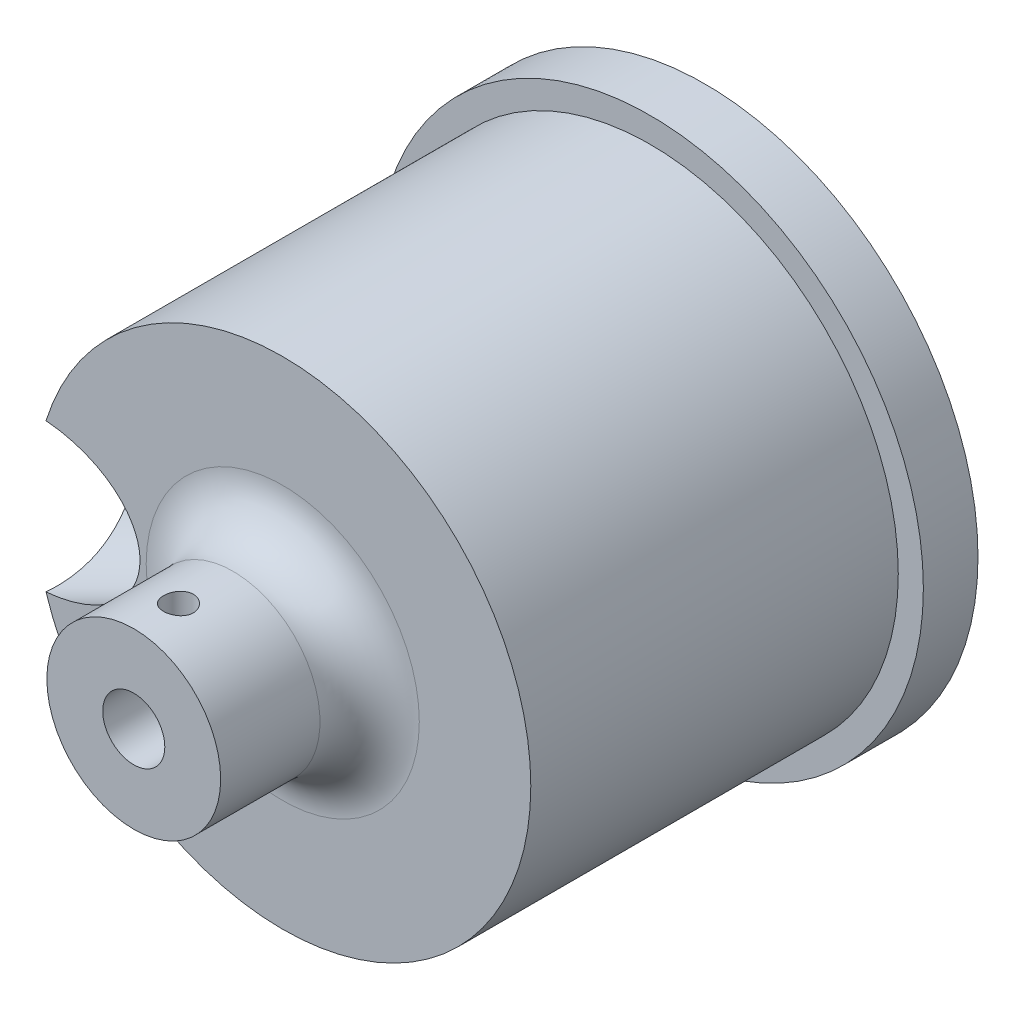
from build123d import *
from build123d.topology import SkipClean

# Parameters (mm, degrees)
IZIM3_OUTSIDE_W             = 75.494
IZIM3_OUTSIDE_H             = 75.494
KES_EKSTR_ZYON1_DEPTH       = 7.5
IZIM4_R                     = 8.75
Y_KSEKLIK_EKSTR_ZYON1_DEPTH = 20
RADYUS1_R                   = 5
KES_EKSTR_ZYON2_DEPTH       = 20
IZIM6_R                     = 1.5
KES_EKSTR_ZYON3_DEPTH       = 60.476886267
IZIM7_R                     = 3.125
KES_EKSTR_ZYON4_DEPTH       = 11
KES_EKSTR_ZYON5_START       = -5
IZIM8_R                     = 8.75
KES_EKSTR_ZYON5_DEPTH       = 5
KES_EKSTR_ZYON6_DEPTH       = 2.5
IZIM11_R                    = 7.5


with BuildPart() as part:
    # Çizim1 → Döndür1 (revolve)
    with BuildSketch(Plane(origin=(0, 0, 0), x_dir=(1, 0, 0), z_dir=(0, 1, 0)), mode=Mode.PRIVATE) as d_nd_r1_sk:
        Polygon((-27.5, 25), (-27.5, 12), (-24.975, 12), (-24.975, -25), (0, -25), (0, 25), align=None)
    revolve(d_nd_r1_sk.sketch.rotate(Axis((0, 0, 25), (0, 0, -1)), 180), axis=Axis((0, 0, 25), (0, 0, -1)))

    # Çizim3 outside → Kes-Ekstrüzyon1 (cut)
    with BuildSketch(Plane(origin=(0, 0, -25), x_dir=(-1, 0, 0), z_dir=(0, 0, -1))):
        Rectangle(IZIM3_OUTSIDE_W, IZIM3_OUTSIDE_H)
        Polygon((15, 0), (7.5, 12.990381057), (-7.5, 12.990381057), (-15, 0), (-7.5, -12.990381057), (7.5, -12.990381057), align=None, mode=Mode.SUBTRACT)
    extrude(amount=-KES_EKSTR_ZYON1_DEPTH, mode=Mode.SUBTRACT)

    # Çizim4 → Yükseklik-Ekstrüzyon1 (add)
    with BuildSketch(Plane.XY.offset(25)):
        Circle(IZIM4_R)
    extrude(amount=Y_KSEKLIK_EKSTR_ZYON1_DEPTH)

    # Radyus1
    radyus1_edges = [part.edges().sort_by_distance(p)[0] for p in [
        (-8.75, 0, 25),
    ]]
    fillet(radyus1_edges, radius=RADYUS1_R)

    # Çizim5 → Kes-Ekstrüzyon2 (cut)
    with BuildSketch(Plane.XY.offset(45)):
        with BuildLine():
            Line((-2.291287847, 2.125), (2.291287847, 2.125))
            ThreePointArc((2.291287847, 2.125), (0, -3.125), (-2.291287847, 2.125))
        make_face()
    extrude(amount=-KES_EKSTR_ZYON2_DEPTH, mode=Mode.SUBTRACT)

    # Çizim6 → Kes-Ekstrüzyon3 (cut, through all)
    with BuildSketch(Plane(origin=(0, 0, 0), x_dir=(1, 0, 0), z_dir=(0, 1, 0))):
        with Locations(Location((0, -35.5, 0), (0, 0, 90))):
            Circle(IZIM6_R)
    extrude(amount=KES_EKSTR_ZYON3_DEPTH, mode=Mode.SUBTRACT)

    # Çizim7 → Kes-Ekstrüzyon4 (cut)
    with SkipClean():  # the faces are left unmerged after this step: merging them gives an invalid solid
        with BuildSketch(Plane.XY.offset(45)):
            Circle(IZIM7_R)
        extrude(amount=-KES_EKSTR_ZYON4_DEPTH, mode=Mode.SUBTRACT)

    # Çizim8 → Kes-Ekstrüzyon5 (cut)
    with SkipClean():  # the faces are left unmerged after this step: merging them gives an invalid solid
        with BuildSketch(Plane.XY.offset(45).offset(KES_EKSTR_ZYON5_START)):
            with Locations(Location((0, 0, 0), (0, 0, 180))):
                Circle(IZIM8_R)
        extrude(amount=KES_EKSTR_ZYON5_DEPTH, mode=Mode.SUBTRACT)

    # Çizim9 → Kes-Ekstrüzyon6 (cut)
    with SkipClean():  # the faces are left unmerged after this step: merging them gives an invalid solid
        with BuildSketch(Plane(origin=(0, 0, -25), x_dir=(-1, 0, 0), z_dir=(0, 0, -1))):
            Polygon((7.5, -12.990381057), (15, 0), (7.5, 12.990381057), (-7.5, 12.990381057), (-15, 0), (-7.5, -12.990381057), align=None)
        extrude(amount=-KES_EKSTR_ZYON6_DEPTH, mode=Mode.SUBTRACT)

    # Kes-Süpür1: sweep along a path in Çizim10
    with SkipClean():  # the faces are left unmerged after this step: merging them gives an invalid solid
        with BuildLine(Plane(origin=(0, 0, 0), x_dir=(1, 0, 0), z_dir=(0, 1, 0))) as kes_s_p_r1_path:
            Line((0, 22.5), (0, 0))
            Line((0, 0), (-24.975, -25))
        # Çizim11 → Kes-Süpür1 (sweep, cut)
        with BuildSketch(Plane(origin=(0, 0, -22.5), x_dir=(-1, 0, 0), z_dir=(0, 0, -1))):
            Circle(IZIM11_R)
        sweep(path=kes_s_p_r1_path.line, transition=Transition.RIGHT, mode=Mode.SUBTRACT)


solid = part.part
